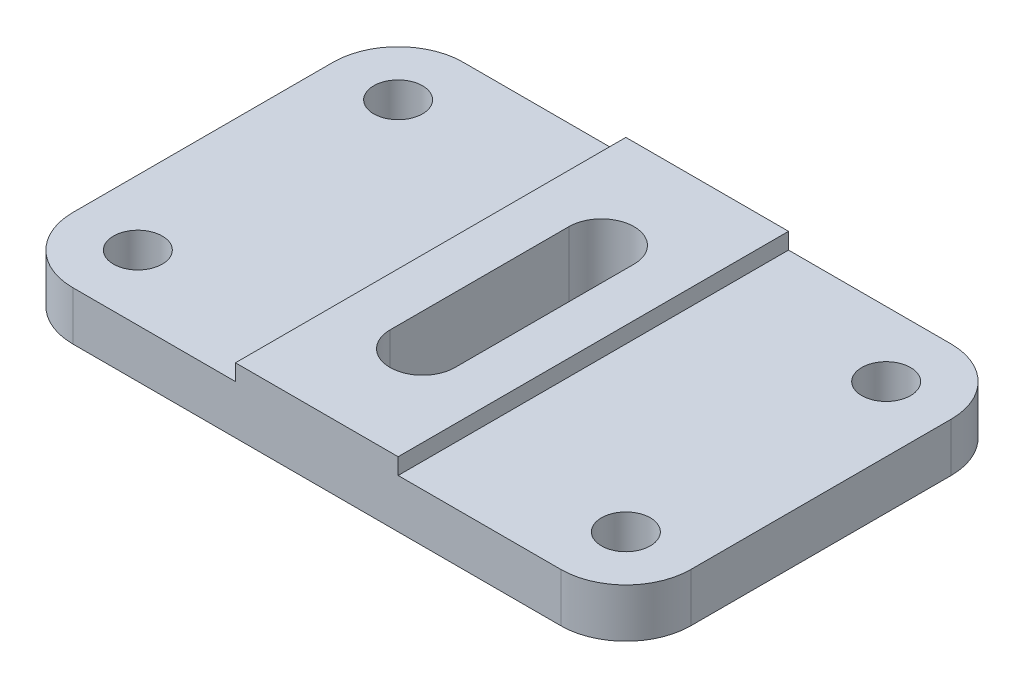
from build123d import *

# Parameters (mm, degrees)
Y_KSEKLIK_EKSTR_ZYON1_DEPTH = 120
RADYUS1_R                   = 20
KES_EKSTR_ZYON1_DEPTH       = 189.006716398
IZIM3_R                     = 7.5
KES_EKSTR_ZYON2_DEPTH       = 188.540730005


with BuildPart() as part:
    # Çizim1 → Yükseklik-Ekstrüzyon1 (new body)
    with BuildSketch(Plane.XY):
        Polygon((-23.340592334, 3.475609756), (46.659407666, 3.475609756), (46.659407666, -11.524390244), (-143.340592334, -11.524390244), (-143.340592334, 3.475609756), (-73.340592334, 3.475609756), (-73.340592334, 8.475609756), (-23.340592334, 8.475609756), align=None)
    extrude(amount=Y_KSEKLIK_EKSTR_ZYON1_DEPTH)

    # Radyus1
    radyus1_edges = [part.edges().sort_by_distance(p)[0] for p in [
        (46.659407666, -4.024390244, 0),
        (-143.340592334, -4.024390244, 0),
        (46.659407666, -4.024390244, 120),
        (-143.340592334, -4.024390244, 120),
    ]]
    fillet(radyus1_edges, radius=RADYUS1_R)

    # Çizim2 → Kes-Ekstrüzyon1 (cut, through all)
    with BuildSketch(Plane(origin=(0, 8.475609756, 0), x_dir=(1, 0, 0), z_dir=(0, 1, 0))):
        with BuildLine():
            Line((-38.340592334, -32.5), (-38.340592334, -87.5))
            ThreePointArc((-38.340592334, -87.5), (-48.340592334, -97.5), (-58.340592334, -87.5))
            Line((-58.340592334, -87.5), (-58.340592334, -32.5))
            ThreePointArc((-58.340592334, -32.5), (-48.340592334, -22.5), (-38.340592334, -32.5))
        make_face()
    extrude(amount=-KES_EKSTR_ZYON1_DEPTH, mode=Mode.SUBTRACT)

    # Çizim3 → Kes-Ekstrüzyon2 (cut, through all)
    with BuildSketch(Plane(origin=(0, 3.475609756, 0), x_dir=(1, 0, 0), z_dir=(0, 1, 0))):
        with Locations(Location((-123.340592334, -20, 0), (0, 0, 270))):
            Circle(IZIM3_R)
        with Locations(Location((-123.340592334, -100, 0), (0, 0, 270))):
            Circle(IZIM3_R)
        with Locations(Location((26.659407666, -100, 0), (0, 0, 90))):
            Circle(IZIM3_R)
        with Locations(Location((26.659407666, -20, 0), (0, 0, 90))):
            Circle(IZIM3_R)
    extrude(amount=-KES_EKSTR_ZYON2_DEPTH, mode=Mode.SUBTRACT)


solid = part.part
